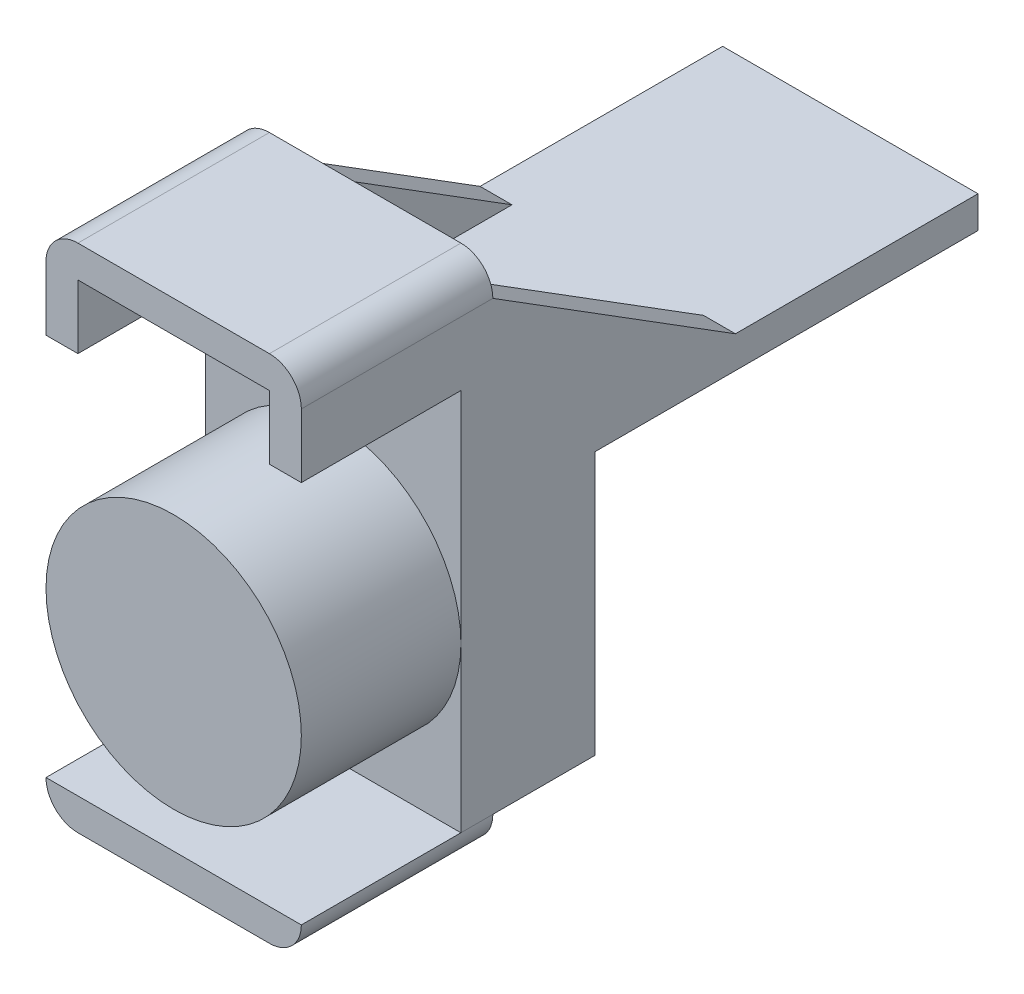
from build123d import *

# Parameters (mm, degrees)
IZIM1_W                     = 30
IZIM1_H                     = 70
Y_KSEKLIK_EKSTR_ZYON1_DEPTH = 30
IZIM2_W                     = 40
IZIM2_H                     = 80
Y_KSEKLIK_EKSTR_ZYON2_DEPTH = 5
RADYUS1_R                   = 5
RADYUS2_R                   = 5
RADYUS3_R                   = 5
RADYUS4_R                   = 5
IZIM4_W                     = 15
IZIM4_H                     = 50
IZIM4_W_2                   = 10
KES_EKSTR_ZYON1_DEPTH       = 59
IZIM5_R                     = 20
Y_KSEKLIK_EKSTR_ZYON4_DEPTH = 30
IZIM6_W                     = 25
IZIM6_H                     = 10
KES_EKSTR_ZYON4_DEPTH       = 7
IZIM7_W                     = 25
IZIM7_H                     = 10
KES_EKSTR_ZYON6_DEPTH       = 7
Y_KSEKLIK_EKSTR_ZYON5_DEPTH = 16
IZIM13_W                    = 40
IZIM13_H                    = 5
Y_KSEKLIK_EKSTR_ZYON6_DEPTH = 60
Y_KSEKLIK_EKSTR_ZYON7_DEPTH = 5
Y_KSEKLIK_EKSTR_ZYON8_DEPTH = 5


with BuildPart() as part:
    # Çizim1 → Yükseklik-Ekstrüzyon1 (new body)
    with BuildSketch(Plane.XY):
        Polygon((5, 0), (0, 0), (0, -5), (0, -80), (35, -80), (40, -80), (40, -75), (40, -5), (40, 0), (35, 0), align=None)
        with Locations((20, -40)):
            Rectangle(IZIM1_W, IZIM1_H, mode=Mode.SUBTRACT)
    extrude(amount=Y_KSEKLIK_EKSTR_ZYON1_DEPTH)

    # Çizim2 → Yükseklik-Ekstrüzyon2 (add)
    with BuildSketch(Plane(origin=(0, 0, 0), x_dir=(-1, 0, 0), z_dir=(0, 0, -1))):
        with Locations((-20, -40)):
            Rectangle(IZIM2_W, IZIM2_H)
    extrude(amount=-Y_KSEKLIK_EKSTR_ZYON2_DEPTH)

    # Radyus1
    radyus1_edges = [part.edges().sort_by_distance(p)[0] for p in [
        (40, 0, 15),
    ]]
    fillet(radyus1_edges, radius=RADYUS1_R)

    # Radyus2
    radyus2_edges = [part.edges().sort_by_distance(p)[0] for p in [
        (0, 0, 15),
    ]]
    fillet(radyus2_edges, radius=RADYUS2_R)

    # Radyus3
    radyus3_edges = [part.edges().sort_by_distance(p)[0] for p in [
        (0, -80, 15),
    ]]
    fillet(radyus3_edges, radius=RADYUS3_R)

    # Radyus4
    radyus4_edges = [part.edges().sort_by_distance(p)[0] for p in [
        (40, -80, 15),
    ]]
    fillet(radyus4_edges, radius=RADYUS4_R)

    # Çizim4 → Kes-Ekstrüzyon1 (cut)
    with BuildSketch(Plane(origin=(40, 0, 0), x_dir=(0, 0, -1), z_dir=(1, 0, 0))):
        with Locations((-22.5, -40)):
            Rectangle(IZIM4_W, IZIM4_H)
        with Locations((-10, -40)):
            Rectangle(IZIM4_W_2, IZIM4_H)
    extrude(amount=-KES_EKSTR_ZYON1_DEPTH, mode=Mode.SUBTRACT)

    # Çizim5 → Yükseklik-Ekstrüzyon4 (add)
    with BuildSketch(Plane(origin=(0, 0, 0), x_dir=(-1, 0, 0), z_dir=(0, 0, -1))):
        with Locations((-20, -49.329631519)):
            Circle(IZIM5_R)
    extrude(amount=-Y_KSEKLIK_EKSTR_ZYON4_DEPTH)

    # Çizim6 → Kes-Ekstrüzyon4 (cut)
    with BuildSketch(Plane(origin=(40, 0, 0), x_dir=(0, 0, -1), z_dir=(1, 0, 0))):
        with Locations((-17.5, -70)):
            Rectangle(IZIM6_W, IZIM6_H)
    extrude(amount=-KES_EKSTR_ZYON4_DEPTH, mode=Mode.SUBTRACT)

    # Çizim7 → Kes-Ekstrüzyon6 (cut)
    with BuildSketch(Plane.ZY):
        with Locations((17.5, -70)):
            Rectangle(IZIM7_W, IZIM7_H)
    extrude(amount=-KES_EKSTR_ZYON6_DEPTH, mode=Mode.SUBTRACT)

    # Çizim12 → Yükseklik-Ekstrüzyon5 (add)
    with BuildSketch(Plane(origin=(0, 0, 0), x_dir=(-1, 0, 0), z_dir=(0, 0, -1))):
        Polygon((-35.259105609, -28.804442177), (-40, -28.804442177), (-40, -33.804442177), (-40, -75), (-35, -75), (-35, -33.804442177), (-5, -33.804442177), (-5, -75), (0, -75), (0, -33.804442177), (0, -28.804442177), (-5, -28.804442177), (-35, -28.804442177), align=None)
    extrude(amount=Y_KSEKLIK_EKSTR_ZYON5_DEPTH)

    # Çizim13 → Yükseklik-Ekstrüzyon6 (add)
    with BuildSketch(Plane(origin=(0, 0, -16), x_dir=(-1, 0, 0), z_dir=(0, 0, -1))):
        with Locations((-20, -31.304442177)):
            Rectangle(IZIM13_W, IZIM13_H)
    extrude(amount=Y_KSEKLIK_EKSTR_ZYON6_DEPTH)

    # Çizim14 → Yükseklik-Ekstrüzyon7 (add)
    with BuildSketch(Plane(origin=(40, 0, 0), x_dir=(0, 0, -1), z_dir=(1, 0, 0))):
        Polygon((0, -5), (38, -28.804442177), (0, -28.804442177), align=None)
    extrude(amount=-Y_KSEKLIK_EKSTR_ZYON7_DEPTH)

    # Çizim15 → Yükseklik-Ekstrüzyon8 (add)
    with BuildSketch(Plane.ZY):
        Polygon((-38, -28.804442177), (0, -5), (0, -28.804442177), align=None)
    extrude(amount=-Y_KSEKLIK_EKSTR_ZYON8_DEPTH)


solid = part.part
